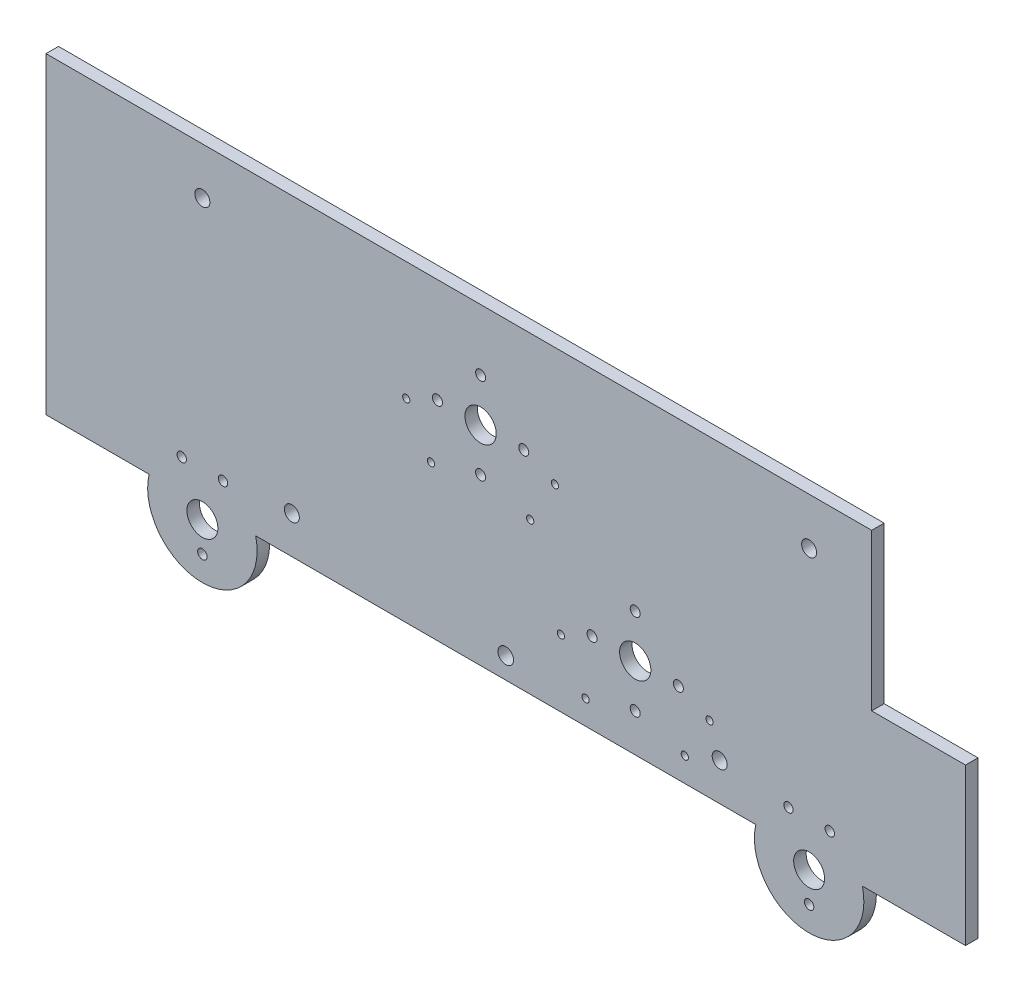
from build123d import *

# Parameters (mm, degrees)
SKETCH2_R           = 3.048
BOSS_EXTRUDE1_DEPTH = 5.07492
SKETCH2_4_R         = 6.2865
CUT_EXTRUDE11_DEPTH = 210.646067011
SKETCH3_R           = 6.35
SKETCH3_R_2         = 2.032
CUT_EXTRUDE12_DEPTH = 210.646067011
SKETCH5_R           = 1.4732
CUT_EXTRUDE13_DEPTH = 210.646067011
SKETCH7_R           = 1.905
CUT_EXTRUDE14_DEPTH = 210.646067011
SKETCH8_R           = 3.175
CUT_EXTRUDE15_DEPTH = 210.646067011
SKETCH9_W           = 38.1
SKETCH9_H           = 63.5
CUT_EXTRUDE16_DEPTH = 5.08


with BuildPart() as part:
    # Sketch2 → Boss-Extrude1 (new body)
    with BuildSketch(Plane.XY):
        with BuildLine():
            Line((-186.69, -31.75), (-144.826640797, -31.75))
            ThreePointArc((-144.826640797, -31.75), (-123.19, -59.055), (-101.553359203, -31.75))
            Line((-101.553359203, -31.75), (101.553359203, -31.75))
            ThreePointArc((101.553359203, -31.75), (123.19, -59.055), (144.826640797, -31.75))
            Line((144.826640797, -31.75), (186.69, -31.75))
            Line((186.69, -31.75), (186.69, 95.25))
            Line((186.69, 95.25), (-186.69, 95.25))
            Line((-186.69, 95.25), (-186.69, -31.75))
        make_face()
        with Locations((-86.868, -16.51)):
            Circle(SKETCH2_R, mode=Mode.SUBTRACT)
        with Locations((86.868, -16.51)):
            Circle(SKETCH2_R, mode=Mode.SUBTRACT)
        with Locations((123.19, 76.2)):
            Circle(SKETCH2_R, mode=Mode.SUBTRACT)
        with Locations((-123.19, 76.2)):
            Circle(SKETCH2_R, mode=Mode.SUBTRACT)
    extrude(amount=-BOSS_EXTRUDE1_DEPTH)

    # Sketch2<4> → Cut-Extrude11 (cut, through all)
    with BuildSketch(Plane.XY):
        with Locations((-123.19, -36.83)):
            Circle(SKETCH2_4_R)
        with Locations((123.19, -36.83)):
            Circle(SKETCH2_4_R)
    extrude(amount=-CUT_EXTRUDE11_DEPTH, mode=Mode.SUBTRACT)

    # Sketch3 → Cut-Extrude12 (cut, through all)
    with BuildSketch(Plane.XY):
        with Locations((-10.209304394, 52.890523875)):
            Circle(SKETCH3_R)
        with Locations((52.574132234, 1.27)):
            Circle(SKETCH3_R)
        with Locations((-27.735304394, 52.890523875)):
            Circle(SKETCH3_R_2)
        with Locations((-10.209304394, 70.416523875)):
            Circle(SKETCH3_R_2)
        with Locations((-10.209304394, 35.364523875)):
            Circle(SKETCH3_R_2)
        with Locations((7.316695606, 52.890523875)):
            Circle(SKETCH3_R_2)
        with Locations((35.048132234, 1.27)):
            Circle(SKETCH3_R_2)
        with Locations((70.100132234, 1.27)):
            Circle(SKETCH3_R_2)
        with Locations((52.574132234, 18.796)):
            Circle(SKETCH3_R_2)
        with Locations((52.574132234, -16.256)):
            Circle(SKETCH3_R_2)
    extrude(amount=-CUT_EXTRUDE12_DEPTH, mode=Mode.SUBTRACT)

    # Sketch5 → Cut-Extrude13 (cut, through all)
    with BuildSketch(Plane.XY):
        with Locations((-40.393083971, 47.101032839)):
            Circle(SKETCH5_R)
        with Locations((19.974475183, 47.101032839)):
            Circle(SKETCH5_R)
        with Locations((-30.346455717, 29.672559007)):
            Circle(SKETCH5_R)
        with Locations((9.927846929, 29.672559007)):
            Circle(SKETCH5_R)
        with Locations((22.390352657, -4.519491037)):
            Circle(SKETCH5_R)
        with Locations((82.757911811, -4.519491037)):
            Circle(SKETCH5_R)
        with Locations((32.436980911, -21.947964868)):
            Circle(SKETCH5_R)
        with Locations((72.711283557, -21.947964868)):
            Circle(SKETCH5_R)
    extrude(amount=-CUT_EXTRUDE13_DEPTH, mode=Mode.SUBTRACT)

    # Sketch7 → Cut-Extrude14 (cut, through all)
    with BuildSketch(Plane.XY):
        with Locations((131.572, -19.05)):
            Circle(SKETCH7_R)
        with Locations((114.808, -19.05)):
            Circle(SKETCH7_R)
        with Locations((-123.19, -49.022)):
            Circle(SKETCH7_R)
        with Locations((-131.572, -19.05)):
            Circle(SKETCH7_R)
        with Locations((-114.808, -19.05)):
            Circle(SKETCH7_R)
        with Locations((123.19, -49.022)):
            Circle(SKETCH7_R)
    extrude(amount=-CUT_EXTRUDE14_DEPTH, mode=Mode.SUBTRACT)

    # Sketch8 → Cut-Extrude15 (cut, through all)
    with BuildSketch(Plane.XY):
        with Locations((0, -23.114)):
            Circle(SKETCH8_R)
    extrude(amount=-CUT_EXTRUDE15_DEPTH, mode=Mode.SUBTRACT)

    # Sketch9 → Cut-Extrude16 (cut)
    with BuildSketch(Plane.XY):
        with Locations((167.64, 63.5)):
            Rectangle(SKETCH9_W, SKETCH9_H)
    extrude(amount=-CUT_EXTRUDE16_DEPTH, mode=Mode.SUBTRACT)


solid = part.part
